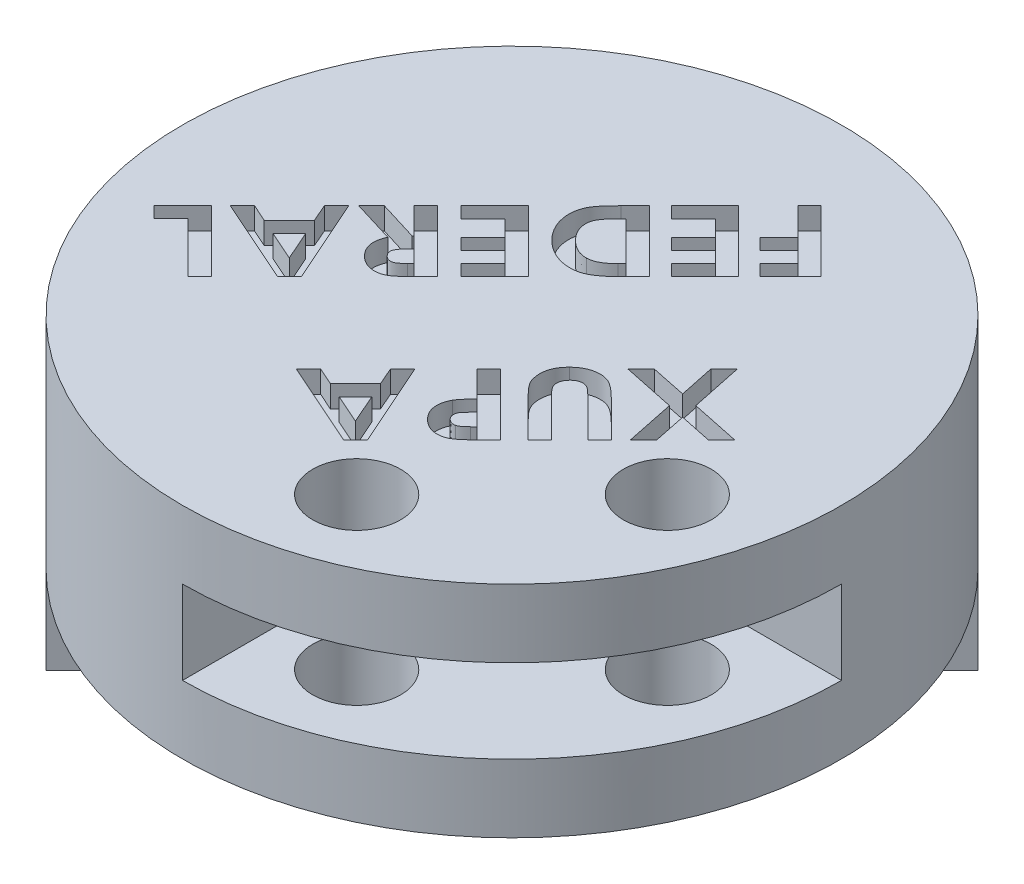
from build123d import *

# Parameters (mm, degrees)
ESBO_O1_R                = 15
RESSALTO_EXTRUS_O1_DEPTH = 10
CORTE_EXTRUS_O1_DEPTH    = 1.9
CORTE_EXTRUS_O2_DEPTH    = 1
ESBO_O4_R                = 2
CORTE_EXTRUS_O3_DEPTH    = 10
RESSALTO_EXTRUS_O2_START = 4
RESSALTO_EXTRUS_O2_DEPTH = 4


with BuildPart() as part:
    # Esboço1 → Ressalto-extrusão1 (new body)
    with BuildSketch(Plane(origin=(0, 0, 0), x_dir=(1, 0, 0), z_dir=(0, 1, 0))):
        with Locations(Location((0, 0, 0), (0, 0, 270))):
            Circle(ESBO_O1_R)
    extrude(amount=RESSALTO_EXTRUS_O1_DEPTH)

    # Esboço2 → Corte-extrusão1 (cut, symmetric)
    with BuildSketch(Plane(origin=(0, 5, 0), x_dir=(1, 0, 0), z_dir=(0, 1, 0))):
        with BuildLine():
            Line((0, 0), (0, -15))
            ThreePointArc((0, -15), (10.606601718, -10.606601718), (15, 0))
            Line((15, 0), (0, 0))
        make_face()
    extrude(amount=CORTE_EXTRUS_O1_DEPTH, both=True, mode=Mode.SUBTRACT)

    # Esboço3 → Corte-extrusão2 (cut)
    # profile 1 of 11: a face of its own
    with BuildSketch(Plane(origin=(0, 10, 0), x_dir=(1, 0, 0), z_dir=(0, 1, 0))):
        Polygon((9.991286616, 0.149286954), (9.391927642, -0.45007202), (7.908754565, -0.139975866), (8.214043026, -1.627956635), (7.614684052, -2.22731561), (7.149940462, 0.017876698), (4.759716103, 0.517075416), (5.359075077, 1.11643439), (6.989684052, 0.779094647), (6.647536616, 2.404895929), (7.250902001, 3.008261313), (7.749299436, 0.617235672), align=None)
    # profile 2 of 11: a face of its own
    with BuildSketch(Plane(origin=(0, 10, 0), x_dir=(1, 0, 0), z_dir=(0, 1, 0))):
        with BuildLine():
            Line((7.180707384, -2.661292278), (6.645450974, -3.196548688))
            Line((6.645450974, -3.196548688), (4.833752256, -1.38484997))
            add(Edge.make_bspline(
                [(4.833752256, -1.38484997), (4.814980423, -1.365951564), (4.778883239, -1.329610987), (4.723852413, -1.280516693), (4.673587811, -1.235055859), (4.625832514, -1.195485687), (4.579817509, -1.163212689), (4.538266899, -1.134352064), (4.499080496, -1.111944161), (4.451298509, -1.089463258), (4.392195918, -1.070709164), (4.319776621, -1.058896446), (4.245405818, -1.060313445), (4.169952547, -1.07207795), (4.094923033, -1.096640536), (4.021417669, -1.13275446), (3.951263817, -1.18272074), (3.90811027, -1.222493458), (3.885835589, -1.243023047)],
                knots=[0, 0, 0, 0, 1.155988666, 2.22290156, 3.200185092, 4.098338149, 4.912408615, 5.639149433, 6.293474047, 6.869225543, 7.928869047, 8.973436072, 10.04015996, 11.143797855, 12.276765443, 13.453784809, 14.68571333, 16, 16, 16, 16], degree=3))
            add(Edge.make_bspline(
                [(3.885835589, -1.243023047), (3.863718248, -1.266452023), (3.820816448, -1.311898048), (3.770289331, -1.38866979), (3.730692615, -1.467401447), (3.706176365, -1.549388313), (3.694162567, -1.630659957), (3.693759699, -1.709589405), (3.70597644, -1.785076419), (3.726206606, -1.846155909), (3.751101425, -1.895430543), (3.776856555, -1.936953032), (3.810285942, -1.982379993), (3.849268564, -2.033086641), (3.896271024, -2.087230999), (3.949147711, -2.146785069), (4.009102225, -2.210806412), (4.052373216, -2.254100113), (4.074938153, -2.276676893)],
                knots=[0, 0, 0, 0, 1.269430647, 2.462360122, 3.612748249, 4.736601737, 5.82345567, 6.8460343, 7.839115339, 8.829226346, 9.371399259, 10.015068757, 10.755267661, 11.596652523, 12.538854489, 13.584166433, 14.740192216, 16, 16, 16, 16], degree=3))
            Line((4.074938153, -2.276676893), (5.820130461, -4.021869201))
            Line((5.820130461, -4.021869201), (5.28487405, -4.557125611))
            Line((5.28487405, -4.557125611), (3.615803538, -2.888055098))
            add(Edge.make_bspline(
                [(3.615803538, -2.888055098), (3.582053694, -2.853960352), (3.517338181, -2.788583486), (3.425818641, -2.693111315), (3.343770788, -2.604634719), (3.272585299, -2.521261891), (3.208842026, -2.446098373), (3.156164459, -2.376187717), (3.112208564, -2.313763509), (3.066898784, -2.23837864), (3.022384135, -2.143530903), (2.98343645, -2.0227707), (2.9550962, -1.893215931), (2.940593664, -1.756244121), (2.938425442, -1.616907874), (2.951959837, -1.479746014), (2.981154044, -1.347571728), (3.024671312, -1.219376631), (3.084818578, -1.095075922), (3.161181387, -0.973650658), (3.252495722, -0.853329337), (3.324134572, -0.778910762), (3.360995845, -0.740619201)],
                knots=[0, 0, 0, 0, 1.156671007, 2.217923112, 3.188722769, 4.065350849, 4.861034249, 5.564279587, 6.175220097, 6.700928795, 7.683279425, 8.693375947, 9.754413098, 10.875210989, 12.008702769, 13.10894238, 14.190228459, 15.265514612, 16.365810762, 17.511258597, 18.719435398, 20, 20, 20, 20], degree=3))
            add(Edge.make_bspline(
                [(3.360995845, -0.740619201), (3.386300292, -0.715946953), (3.436196282, -0.667297549), (3.515733708, -0.601724864), (3.597252525, -0.543258255), (3.679177841, -0.489780506), (3.764206752, -0.444927982), (3.850530585, -0.406235762), (3.939307655, -0.374916631), (4.029347985, -0.350315193), (4.119572131, -0.331947416), (4.208443518, -0.31976766), (4.295467345, -0.314323142), (4.380615597, -0.313973418), (4.464196891, -0.3204774), (4.545978902, -0.333089432), (4.625621203, -0.352826987), (4.705422235, -0.377654043), (4.78700273, -0.413128641), (4.872909824, -0.460395543), (4.964971524, -0.519012865), (5.062714695, -0.590190558), (5.167130555, -0.672873699), (5.276950527, -0.768399261), (5.393780657, -0.874930422), (5.471335911, -0.952113963), (5.511636871, -0.992221765)],
                knots=[0, 0, 0, 0, 1.021916422, 2.015042341, 2.977805161, 3.922892496, 4.842241783, 5.755304681, 6.656954872, 7.562205534, 8.453100996, 9.318439889, 10.154558045, 10.973474217, 11.77931275, 12.576962411, 13.363952912, 14.150677929, 14.991636173, 15.931911616, 16.984242602, 18.146377834, 19.427737307, 20.835519037, 22.355603098, 24, 24, 24, 24], degree=3))
            Line((5.511636871, -0.992221765), (7.180707384, -2.661292278))
        make_face()
    # profile 3 of 11: a face of its own
    with BuildSketch(Plane(origin=(0, 10, 0), x_dir=(1, 0, 0), z_dir=(0, 1, 0))):
        with BuildLine():
            Line((4.66100903, -5.180990632), (4.096105184, -5.745894478))
            add(Edge.make_bspline(
                [(4.096105184, -5.745894478), (4.058899857, -5.782415165), (3.987162549, -5.852832388), (3.880516245, -5.951389838), (3.779570243, -6.039957989), (3.683797787, -6.117737072), (3.593060216, -6.184467826), (3.508013876, -6.241064867), (3.428247607, -6.287204446), (3.329197095, -6.332873766), (3.207098245, -6.372940176), (3.058017376, -6.396654712), (2.906578837, -6.395390919), (2.78036702, -6.375146777), (2.679743636, -6.347952776), (2.605186391, -6.320352266), (2.531684934, -6.287413957), (2.459813265, -6.248012179), (2.388782625, -6.202903995), (2.319406772, -6.15151218), (2.250745488, -6.094696823), (2.207725016, -6.052571792), (2.185848773, -6.031150888)],
                knots=[0, 0, 0, 0, 1.406641271, 2.712209948, 3.917624628, 5.029648842, 6.04009536, 6.955560074, 7.785096033, 8.523504981, 9.895491185, 11.237914943, 12.57840281, 13.964662288, 14.674488314, 15.388109057, 16.107420444, 16.845934891, 17.597658369, 18.376028278, 19.174197811, 20, 20, 20, 20], degree=3))
            add(Edge.make_bspline(
                [(2.185848773, -6.031150888), (2.162217551, -6.006664106), (2.116155653, -5.958934553), (2.054842338, -5.882603463), (2.000906484, -5.805148008), (1.955279826, -5.725315212), (1.91612517, -5.644561259), (1.886798154, -5.561308051), (1.863967142, -5.477024351), (1.849478777, -5.391134343), (1.843653057, -5.304505593), (1.842948248, -5.217656675), (1.851610967, -5.131170704), (1.865803242, -5.044839417), (1.887683955, -4.958859256), (1.916558787, -4.873135626), (1.952709914, -4.787658), (1.981909226, -4.732337631), (1.996746209, -4.704227811)],
                knots=[0, 0, 0, 0, 1.126101865, 2.194993951, 3.23744383, 4.247590149, 5.236418428, 6.204186264, 7.165102631, 8.124553194, 9.082168344, 10.037167055, 10.996250816, 11.955701378, 12.931515311, 13.929787448, 14.948067339, 16, 16, 16, 16], degree=3))
            add(Edge.make_bspline(
                [(1.996746209, -4.704227811), (2.00715326, -4.686420805), (2.029646495, -4.647933709), (2.072462865, -4.5895141), (2.123799586, -4.524038906), (2.18356915, -4.451325673), (2.252895899, -4.372604602), (2.331773478, -4.287693575), (2.419640827, -4.195785443), (2.481957248, -4.132817325), (2.514374414, -4.100061144)],
                knots=[0, 0, 0, 0, 0.620398817, 1.340896353, 2.177090738, 3.125061034, 4.173198094, 5.333690957, 6.612979008, 8, 8, 8, 8], degree=3))
            Line((2.514374414, -4.100061144), (1.328476979, -2.914163709))
            Line((1.328476979, -2.914163709), (1.861329543, -2.381311144))
            Line((1.861329543, -2.381311144), (4.66100903, -5.180990632))
        make_face()
        with BuildLine():
            Line((3.033605184, -4.619291914), (2.864534671, -4.788362426))
            add(Edge.make_bspline(
                [(2.864534671, -4.788362426), (2.833968437, -4.819249334), (2.777822167, -4.875984639), (2.706331587, -4.958635987), (2.652342591, -5.028904288), (2.615009506, -5.090153714), (2.594559971, -5.147108986), (2.581418874, -5.201408668), (2.579789494, -5.256704534), (2.584815693, -5.312227712), (2.600417936, -5.366879169), (2.624841393, -5.419493209), (2.658183245, -5.470176911), (2.686427331, -5.500304203), (2.701073132, -5.515926529)],
                knots=[0, 0, 0, 0, 1.826704509, 3.35542295, 4.590751503, 5.551906901, 6.355007882, 7.126061508, 7.890461977, 8.669327237, 9.462234463, 10.266198699, 11.100947754, 12, 12, 12, 12], degree=3))
            add(Edge.make_bspline(
                [(2.701073132, -5.515926529), (2.714422462, -5.528526519), (2.740447557, -5.553090743), (2.782915233, -5.583686249), (2.826854491, -5.606908432), (2.871117414, -5.625299732), (2.91744213, -5.63587945), (2.96492254, -5.638421867), (3.013801283, -5.636760433), (3.045967038, -5.629449087), (3.062451338, -5.62570217)],
                knots=[0, 0, 0, 0, 1.109423344, 2.162868797, 3.152982245, 4.10985909, 5.05424694, 6.009486231, 6.979901905, 8, 8, 8, 8], degree=3))
            add(Edge.make_bspline(
                [(3.062451338, -5.62570217), (3.075415411, -5.622078795), (3.102909821, -5.614394285), (3.143922606, -5.593768507), (3.188729943, -5.568336405), (3.236627386, -5.536148558), (3.287459517, -5.497352779), (3.340833261, -5.451175205), (3.398559388, -5.399653154), (3.436823303, -5.361730181), (3.456682107, -5.342048324)],
                knots=[0, 0, 0, 0, 0.657275167, 1.393959472, 2.23694375, 3.179428826, 4.214595909, 5.3643029, 6.632084791, 8, 8, 8, 8], degree=3))
            Line((3.456682107, -5.342048324), (3.60652185, -5.19220858))
            Line((3.60652185, -5.19220858), (3.033605184, -4.619291914))
        make_face(mode=Mode.SUBTRACT)
    # profile 4 of 11: a face of its own
    with BuildSketch(Plane(origin=(0, 10, 0), x_dir=(1, 0, 0), z_dir=(0, 1, 0))):
        Polygon((1.63112919, -8.210870471), (1.090263806, -8.751735856), (-2.786338758, -7.028979446), (-2.232652861, -6.475293548), (-1.436979784, -6.833466625), (-0.295152861, -5.691639702), (-0.643710553, -4.88635124), (-0.089223374, -4.331864061), align=None)
        Polygon((0.614302267, -7.742120471), (0.026161242, -6.408787138), (-0.717428502, -7.152376881), align=None, mode=Mode.SUBTRACT)
    # profile 5 of 11: a face of its own
    with BuildSketch(Plane(origin=(0, 10, 0), x_dir=(1, 0, 0), z_dir=(0, 1, 0))):
        Polygon((5.521678914, 8.552648859), (4.13305712, 7.164027064), (3.613025068, 7.684059116), (4.475204555, 8.546238603), (3.967191735, 9.054251423), (3.105012248, 8.192071936), (2.592993017, 8.704091167), (3.455172504, 9.566270654), (2.19555712, 10.825886039), (2.721999427, 11.352328346), align=None)
    # profile 6 of 11: a face of its own
    with BuildSketch(Plane(origin=(0, 10, 0), x_dir=(1, 0, 0), z_dir=(0, 1, 0))):
        Polygon((3.642471088, 6.673441032), (2.113624934, 5.144594879), (1.591990318, 5.666229494), (2.591189036, 6.665428212), (2.08477878, 7.171838468), (1.085580062, 6.17263975), (0.573560831, 6.684658981), (1.572759549, 7.683857699), (0.836381344, 8.420235904), (-0.162817374, 7.421037186), (-0.686054553, 7.944274366), (0.8427916, 9.47312052), align=None)
    # profile 7 of 11: a face of its own
    with BuildSketch(Plane(origin=(0, 10, 0), x_dir=(1, 0, 0), z_dir=(0, 1, 0))):
        with BuildLine():
            Line((1.61180546, 4.642775404), (0.979593921, 4.010563866))
            add(Edge.make_bspline(
                [(0.979593921, 4.010563866), (0.929955243, 3.961899915), (0.833730032, 3.867564227), (0.689122426, 3.735963705), (0.548694859, 3.619825101), (0.414063887, 3.516981218), (0.283616507, 3.430162249), (0.159260135, 3.355672145), (0.038730318, 3.298193664), (-0.077388171, 3.252858053), (-0.192599672, 3.220439478), (-0.30893124, 3.197938641), (-0.427953285, 3.18535857), (-0.549534834, 3.181346351), (-0.673762244, 3.186339777), (-0.800715014, 3.199871418), (-0.930250679, 3.223449694), (-1.06158577, 3.256317318), (-1.1933281, 3.297377435), (-1.323248245, 3.349058165), (-1.450288773, 3.411125063), (-1.575679961, 3.481371046), (-1.697810564, 3.562363154), (-1.818004801, 3.651823456), (-1.935465773, 3.751721534), (-2.010371453, 3.82398688), (-2.048450951, 3.860724122)],
                knots=[0, 0, 0, 0, 1.439034866, 2.789587404, 4.046242051, 5.210749521, 6.294998322, 7.288851825, 8.208867441, 9.056044777, 9.866460813, 10.683040655, 11.506165398, 12.341567733, 13.199272088, 14.077965293, 14.98253088, 15.92263245, 16.879224752, 17.837222352, 18.814071862, 19.804442961, 20.810496319, 21.845608965, 22.904780916, 24, 24, 24, 24], degree=3))
            add(Edge.make_bspline(
                [(-2.048450951, 3.860724122), (-2.099953016, 3.914847336), (-2.201382212, 4.021438673), (-2.333664719, 4.194340895), (-2.445882211, 4.374211473), (-2.538081491, 4.559263389), (-2.608335019, 4.747748126), (-2.659103552, 4.935677989), (-2.686556813, 5.123136184), (-2.692167943, 5.307847716), (-2.677337095, 5.486581821), (-2.646890883, 5.657253738), (-2.596599994, 5.817699827), (-2.539753685, 5.945782252), (-2.480563989, 6.04791725), (-2.423013217, 6.131441473), (-2.354550386, 6.224073629), (-2.274092279, 6.324778171), (-2.179228875, 6.431600904), (-2.074618778, 6.548359536), (-1.956611702, 6.672167057), (-1.873106567, 6.756692171), (-1.829700951, 6.800627968)],
                knots=[0, 0, 0, 0, 1.317839513, 2.595379447, 3.834063156, 5.05466701, 6.237550534, 7.378660222, 8.483962212, 9.57336849, 10.63268142, 11.644157635, 12.626693665, 13.593039203, 14.110493631, 14.707986141, 15.382087559, 16.143302665, 16.981856857, 17.903007519, 18.909992176, 20, 20, 20, 20], degree=3))
            Line((-1.829700951, 6.800627968), (-1.187874028, 7.442454892))
            Line((-1.187874028, 7.442454892), (1.61180546, 4.642775404))
        make_face()
        with BuildLine():
            Line((0.566132383, 4.625948481), (-1.197489412, 6.389570276))
            Line((-1.197489412, 6.389570276), (-1.445085566, 6.141974122))
            add(Edge.make_bspline(
                [(-1.445085566, 6.141974122), (-1.474072863, 6.112195469), (-1.5300926, 6.054646385), (-1.608685633, 5.969364403), (-1.677992826, 5.887339926), (-1.738365151, 5.808862459), (-1.789700144, 5.733658248), (-1.832466631, 5.662321859), (-1.866757924, 5.59476385), (-1.900020318, 5.509252307), (-1.924839801, 5.399946591), (-1.93298642, 5.263734065), (-1.916844295, 5.121156201), (-1.882342812, 4.972934383), (-1.821924328, 4.822593905), (-1.737822598, 4.672801422), (-1.628275365, 4.525190933), (-1.541453534, 4.433288237), (-1.496367617, 4.385563866)],
                knots=[0, 0, 0, 0, 0.979925141, 1.893765722, 2.734044598, 3.511273851, 4.227493601, 4.879892629, 5.47138308, 6.011741413, 7.039904603, 8.099867681, 9.214125303, 10.411785622, 11.678404231, 13.020547134, 14.452792779, 16, 16, 16, 16], degree=3))
            add(Edge.make_bspline(
                [(-1.496367617, 4.385563866), (-1.459507618, 4.350249264), (-1.387635004, 4.281389991), (-1.273581075, 4.190528159), (-1.157805479, 4.114202405), (-1.041103248, 4.050569791), (-0.922222936, 4.002358915), (-0.801565165, 3.968429674), (-0.679520514, 3.94762683), (-0.597408463, 3.945245094), (-0.556463771, 3.944057456)],
                knots=[0, 0, 0, 0, 1.147925532, 2.238318219, 3.274870098, 4.264161038, 5.223719486, 6.153875931, 7.079441097, 8, 8, 8, 8], degree=3))
            add(Edge.make_bspline(
                [(-0.556463771, 3.944057456), (-0.518948996, 3.945973197), (-0.442663105, 3.949868837), (-0.328303065, 3.975221391), (-0.212427678, 4.014922991), (-0.095655832, 4.071140957), (0.023685143, 4.141138996), (0.143928153, 4.227695651), (0.265608741, 4.329664355), (0.344369404, 4.40562927), (0.385042639, 4.444858738)],
                knots=[0, 0, 0, 0, 0.823804914, 1.675198423, 2.561952133, 3.509254724, 4.516353536, 5.597223391, 6.759168657, 8, 8, 8, 8], degree=3))
            Line((0.385042639, 4.444858738), (0.566132383, 4.625948481))
        make_face(mode=Mode.SUBTRACT)
    # profile 8 of 11: a face of its own
    with BuildSketch(Plane(origin=(0, 10, 0), x_dir=(1, 0, 0), z_dir=(0, 1, 0))):
        Polygon((-1.144097893, 1.886872052), (-2.672944047, 0.358025898), (-3.194578662, 0.879660514), (-2.195379944, 1.878859232), (-2.7017902, 2.385269488), (-3.700988918, 1.38607077), (-4.213008149, 1.898090001), (-3.213809431, 2.897288719), (-3.950187636, 3.633666924), (-4.949386354, 2.634468206), (-5.472623534, 3.157705385), (-3.94377738, 4.686551539), align=None)
    # profile 9 of 11: a face of its own
    with BuildSketch(Plane(origin=(0, 10, 0), x_dir=(1, 0, 0), z_dir=(0, 1, 0))):
        with BuildLine():
            Line((-3.209218649, -0.178248704), (-3.774923777, -0.743953832))
            add(Edge.make_bspline(
                [(-3.774923777, -0.743953832), (-3.812356447, -0.781049851), (-3.884428262, -0.852473487), (-3.992157002, -0.951804591), (-4.093517901, -1.041050155), (-4.189583868, -1.118712869), (-4.279663073, -1.185960447), (-4.364117423, -1.242032915), (-4.442996539, -1.287449707), (-4.539268657, -1.333622616), (-4.659996696, -1.370609466), (-4.807683988, -1.394256385), (-4.959631962, -1.391504627), (-5.087192912, -1.371702422), (-5.189084702, -1.344251517), (-5.264816858, -1.316974717), (-5.339171735, -1.284068903), (-5.411365111, -1.244268715), (-5.482648168, -1.1994902), (-5.552644368, -1.149118559), (-5.620042261, -1.091645204), (-5.663216038, -1.050262968), (-5.685180187, -1.029210243)],
                knots=[0, 0, 0, 0, 1.421978541, 2.737837732, 3.953519399, 5.065633402, 6.070361753, 6.985900385, 7.799411416, 8.524821276, 9.862857507, 11.190037478, 12.545105683, 13.945717307, 14.662554921, 15.389788545, 16.115735282, 16.85430936, 17.612184021, 18.386367678, 19.179083583, 20, 20, 20, 20], degree=3))
            add(Edge.make_bspline(
                [(-5.685180187, -1.029210243), (-5.707457564, -1.00630748), (-5.7511841, -0.96135342), (-5.809201414, -0.889437901), (-5.862247447, -0.817806799), (-5.905656535, -0.743196216), (-5.94520826, -0.669088564), (-5.975254788, -0.592205073), (-5.999610573, -0.514654328), (-6.016533682, -0.435530308), (-6.026225965, -0.355066852), (-6.028308697, -0.273301396), (-6.024446169, -0.189951158), (-6.013096344, -0.105276941), (-5.994666359, -0.019247609), (-5.968228717, 0.067704593), (-5.936872663, 0.156678357), (-5.91026071, 0.215099416), (-5.896718649, 0.244828219)],
                knots=[0, 0, 0, 0, 1.101414134, 2.161880473, 3.184660909, 4.172144899, 5.136319069, 6.0789497, 7.014349383, 7.937694207, 8.865577957, 9.805684083, 10.755713988, 11.740745346, 12.749025231, 13.786758006, 14.873744543, 16, 16, 16, 16], degree=3))
            Line((-5.896718649, 0.244828219), (-7.803769931, 0.826558988))
            Line((-7.803769931, 0.826558988), (-7.22123788, 1.409091039))
            Line((-7.22123788, 1.409091039), (-5.405532751, 0.853001296))
            Line((-5.405532751, 0.853001296), (-5.355853264, 0.902680783))
            Line((-5.355853264, 0.902680783), (-6.5417507, 2.088578219))
            Line((-6.5417507, 2.088578219), (-6.008898136, 2.621430783))
            Line((-6.008898136, 2.621430783), (-3.209218649, -0.178248704))
        make_face()
        with BuildLine():
            Line((-4.836622495, 0.383450014), (-5.004090444, 0.215982065))
            add(Edge.make_bspline(
                [(-5.004090444, 0.215982065), (-5.024303969, 0.195318491), (-5.063040143, 0.155719867), (-5.115882047, 0.096071422), (-5.162821256, 0.04022553), (-5.202363187, -0.013465379), (-5.234178271, -0.064527945), (-5.259911201, -0.112132336), (-5.277642827, -0.157408821), (-5.292989023, -0.21316122), (-5.295818491, -0.283240194), (-5.273827657, -0.365508774), (-5.230236331, -0.446746638), (-5.18666919, -0.493812816), (-5.163545572, -0.518793576)],
                knots=[0, 0, 0, 0, 1.201335271, 2.302177953, 3.311429629, 4.232969088, 5.070863541, 5.810798595, 6.478771136, 7.08736359, 8.209552627, 9.343161366, 10.589861104, 12, 12, 12, 12], degree=3))
            add(Edge.make_bspline(
                [(-5.163545572, -0.518793576), (-5.148122996, -0.532818617), (-5.118001012, -0.560211061), (-5.067958082, -0.593769247), (-5.014157175, -0.617242502), (-4.958110589, -0.63156432), (-4.900829785, -0.637234529), (-4.843737272, -0.634155032), (-4.787398724, -0.621547692), (-4.740778122, -0.604429306), (-4.702585112, -0.583755414), (-4.669750961, -0.564104211), (-4.634702035, -0.537898981), (-4.596196375, -0.50716611), (-4.55355843, -0.472410563), (-4.50904332, -0.430779751), (-4.460074137, -0.385760447), (-4.427316494, -0.353051884), (-4.410340444, -0.336101268)],
                knots=[0, 0, 0, 0, 1.128447796, 2.203982445, 3.247103288, 4.292930286, 5.325256976, 6.354231782, 7.375957681, 8.442892605, 9.031898334, 9.726743301, 10.513977804, 11.399823452, 12.396550797, 13.492525903, 14.700547375, 16, 16, 16, 16], degree=3))
            Line((-4.410340444, -0.336101268), (-4.263705828, -0.189466653))
            Line((-4.263705828, -0.189466653), (-4.836622495, 0.383450014))
        make_face(mode=Mode.SUBTRACT)
    # profile 10 of 11: a face of its own
    with BuildSketch(Plane(origin=(0, 10, 0), x_dir=(1, 0, 0), z_dir=(0, 1, 0))):
        Polygon((-6.310223891, -3.279253946), (-6.851089275, -3.820119331), (-10.727691839, -2.09736292), (-10.174005942, -1.543677023), (-9.378332865, -1.9018501), (-8.236505942, -0.760023177), (-8.585063634, 0.045265285), (-8.030576455, 0.599752464), align=None)
        Polygon((-7.327050814, -2.810503946), (-7.915191839, -1.477170613), (-8.658781583, -2.220760356), align=None, mode=Mode.SUBTRACT)
    # profile 11 of 11: a face of its own
    with BuildSketch(Plane(origin=(0, 10, 0), x_dir=(1, 0, 0), z_dir=(0, 1, 0))):
        Polygon((-8.358610685, -5.327640741), (-8.891463249, -5.860493305), (-11.183129916, -3.568826638), (-11.959572224, -4.345268946), (-12.467585044, -3.837256125), (-11.158290172, -2.527961253), align=None)
    extrude(amount=-CORTE_EXTRUS_O2_DEPTH, mode=Mode.SUBTRACT)

    # Esboço4 → Corte-extrusão3 (cut)
    with BuildSketch(Plane(origin=(0, 10, 0), x_dir=(1, 0, 0), z_dir=(0, 1, 0))):
        with Locations(Location((10.606601718, -3.535533906, 0), (0, 0, 270))):
            Circle(ESBO_O4_R)
        with Locations(Location((3.535533906, -10.606601718, 0), (0, 0, 270))):
            Circle(ESBO_O4_R)
    extrude(amount=-CORTE_EXTRUS_O3_DEPTH, mode=Mode.SUBTRACT)

    # Esboço5 → Ressalto-extrusão2 (add)
    with BuildSketch(Plane.XZ.offset(RESSALTO_EXTRUS_O2_START)):
        with BuildLine():
            Line((-10.606601718, 10.606601718), (10.606601718, -10.606601718))
            ThreePointArc((10.606601718, -10.606601718), (-10.606601718, -10.606601718), (-10.606601718, 10.606601718))
        make_face()
    extrude(amount=-RESSALTO_EXTRUS_O2_DEPTH)


solid = part.part
